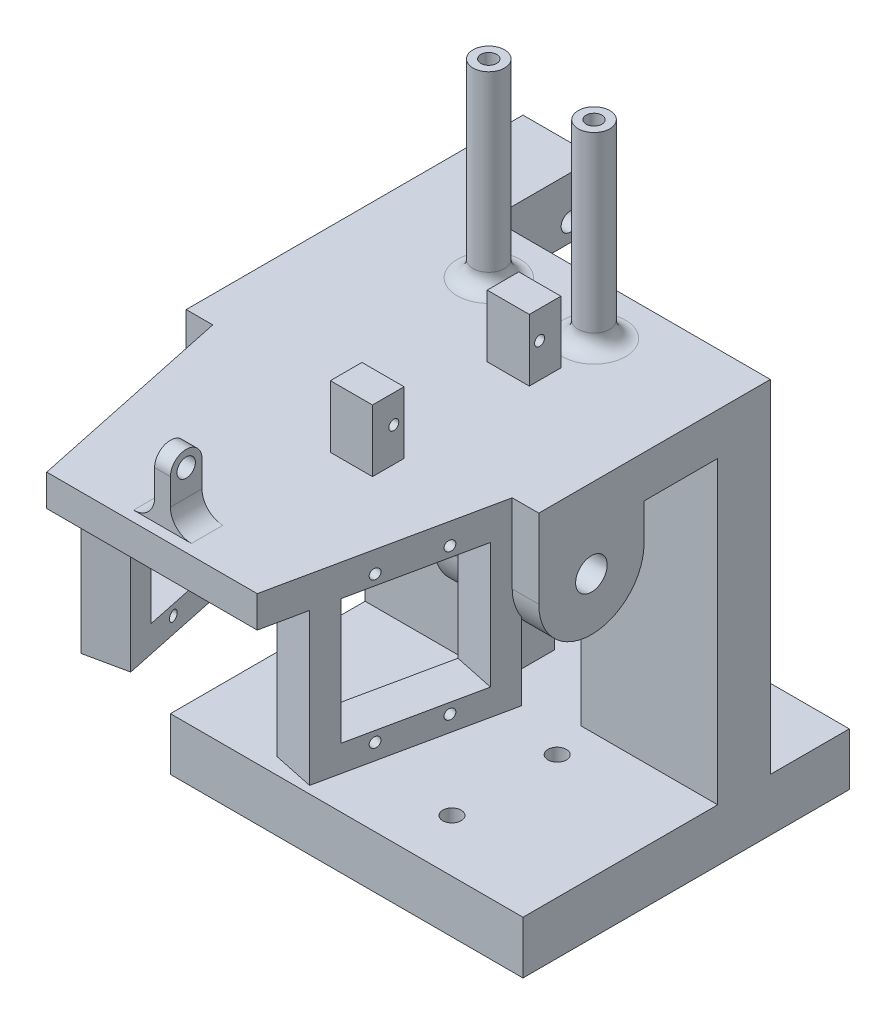
from build123d import *

# Parameters (mm, degrees)
SKETCH_1_W             = 67
SKETCH_1_H             = 62
EXTRUDE_1_DEPTH        = 10
SKETCH_3_W             = 14
SKETCH_3_H             = 20
EXTRUDE_2_DEPTH        = 12.5
SKETCH_4_W             = 10
SKETCH_4_H             = 65
EXTRUDE_3_DEPTH        = 67
SKETCH_5_W             = 67
SKETCH_5_H             = 44
EXTRUDE_4_DEPTH        = 8
EXTRUDE_5_DEPTH        = 20
CUT_EXTRUDE_START      = -6
CUT_EXTRUDE_1_DEPTH    = 8
EXTRUDE_6_DEPTH        = 6
SKETCH_9_R             = 3
CUT_EXTRUDE_2_DEPTH    = 23
SKETCH_10_W            = 24
SKETCH_10_H            = 23.8
EXTRUDE_7_DEPTH        = 8
SKETCH_12_W            = 14
SKETCH_12_H            = 20
EXTRUDE_8_DEPTH        = 11.5
SKETCH_13_R            = 0.95
CUT_EXTRUDE_4_DEPTH    = 8
SKETCH_14_W            = 8
SKETCH_14_H            = 6
EXTRUDE_9_DEPTH        = 11.8
SKETCH_15_R            = 0.95
CUT_EXTRUDE_5_DEPTH    = 11.8
SKETCH_16_W            = 3
SKETCH_16_H            = 6
EXTRUDE_10_DEPTH       = 12
FILLET_1_RADIUS        = 3
FILLET_1_LENGTH        = 3
SKETCH_17_R            = 1.75
CUT_EXTRUDE_6_DEPTH    = 7
SKETCH_18_R            = 3
EXTRUDE_11_DEPTH       = 36
FILLET_2_R             = 3
FILLET_2_OF_MIRROR_1_R = 3
SKETCH_20_R            = 1.75
CUT_EXTRUDE_7_DEPTH    = 35
SKETCH_21_W            = 15
SKETCH_21_H            = 55
CUT_EXTRUDE_8_DEPTH    = 35
SKETCH_24_R            = 1.75
CUT_EXTRUDE_11_DEPTH   = 18
SKETCH_25_R            = 1.5
CUT_EXTRUDE_12_DEPTH   = 10
FILLET_3_R             = 4
SKETCH_26_W            = 10
SKETCH_26_H            = 3.6
EXTRUDE_12_DEPTH       = 1
SKETCH_27_R            = 1.4
CUT_EXTRUDE_13_DEPTH   = 4


with BuildPart() as part:
    # 草图1 → 凸台-拉伸1 (new body)
    with BuildSketch(Plane(origin=(0, 0, 0), x_dir=(1, 0, 0), z_dir=(0, 1, 0))):
        Rectangle(SKETCH_1_W, SKETCH_1_H)
    extrude(amount=EXTRUDE_1_DEPTH)

    # 草图3 → 凸台-拉伸2 (add)
    with BuildSketch(Plane(origin=(0, 10, 0), x_dir=(1, 0, 0), z_dir=(0, 1, 0))):
        with Locations((-26.5, 26)):
            Rectangle(SKETCH_3_W, SKETCH_3_H)
    extrude(amount=EXTRUDE_2_DEPTH)

    # 草图4 → 凸台-拉伸3 (add)
    with BuildSketch(Plane.ZY.offset(33.5)):
        with Locations((-11, 42.5)):
            Rectangle(SKETCH_4_W, SKETCH_4_H)
    extrude(amount=-EXTRUDE_3_DEPTH)

    # 草图5 → 凸台-拉伸4 (add)
    with BuildSketch(Plane(origin=(0, 75, 0), x_dir=(1, 0, 0), z_dir=(0, 1, 0))):
        with Locations((0, -6)):
            Rectangle(SKETCH_5_W, SKETCH_5_H)
    extrude(amount=-EXTRUDE_4_DEPTH)

    # 草图6 → 凸台-拉伸5 (add)
    with BuildSketch(Plane(origin=(33.5, 0, 0), x_dir=(0, 0, -1), z_dir=(1, 0, 0))):
        with BuildLine():
            Line((-28, 60), (-28, 67))
            Line((-28, 67), (-8, 67))
            Line((-8, 67), (-8, 60))
            ThreePointArc((-8, 60), (-18, 50), (-28, 60))
        make_face()
    extrude_5 = extrude(amount=-EXTRUDE_5_DEPTH)

    # 草图7 → 切除-拉伸1 (cut)
    with BuildSketch(Plane(origin=(33.5, 0, 0), x_dir=(0, 0, -1), z_dir=(1, 0, 0)).offset(CUT_EXTRUDE_START)):
        with BuildLine():
            Line((-28, 60), (-28, 70.000230089))
            Line((-28, 70.000230089), (-8, 70.000230089))
            Line((-8, 70.000230089), (-8, 60))
            ThreePointArc((-8, 60), (-18, 50), (-28, 60))
        make_face()
    cut_extrude_1 = extrude(amount=-CUT_EXTRUDE_1_DEPTH, mode=Mode.SUBTRACT)

    # 草图8 → 凸台-拉伸6 (add)
    with BuildSketch(Plane(origin=(0, 75, 0), x_dir=(1, 0, 0), z_dir=(0, 1, 0))):
        Polygon((0, -68), (20, -68), (28.452456914, -28), (0, -28), align=None)
    extrude_6 = extrude(amount=-EXTRUDE_6_DEPTH)

    # 草图9 → 切除-拉伸2 (cut)
    with BuildSketch(Plane(origin=(33.5, 0, 0), x_dir=(0, 0, -1), z_dir=(1, 0, 0))):
        with Locations((-18, 60)):
            Circle(SKETCH_9_R)
    cut_extrude_2 = extrude(amount=-CUT_EXTRUDE_2_DEPTH, mode=Mode.SUBTRACT)

    # 草图10 → 凸台-拉伸7 (add)
    with BuildSketch(Plane(origin=(32.900104274, 0, 6.952167846), x_dir=(0.20674596709610937, 0, -0.9783946571243602), z_dir=(0.9783946571243602, 0, 0.20674596709610937))):
        Polygon((-49, 75), (-20, 75), (-20, 40.2), (-48, 40.2), (-54, 40.2), (-54, 75), align=None)
        with Locations((-37, 57.1)):
            Rectangle(SKETCH_10_W, SKETCH_10_H, mode=Mode.SUBTRACT)
    extrude_7 = extrude(amount=-EXTRUDE_7_DEPTH)

    # 草图12 → 凸台-拉伸8 (add)
    with BuildSketch(Plane(origin=(0, 75, 0), x_dir=(1, 0, 0), z_dir=(0, 1, 0))):
        with Locations((-26.5, 26)):
            Rectangle(SKETCH_12_W, SKETCH_12_H)
    extrude(amount=-EXTRUDE_8_DEPTH)

    # 草图13 → 切除-拉伸4 (cut)
    with BuildSketch(Plane(origin=(25.072947017, 0, 5.298200109), x_dir=(-0.20674596709610943, 0, 0.9783946571243602), z_dir=(-0.9783946571243602, 0, -0.20674596709610943))):
        with Locations((43.5, 70.95)):
            Circle(SKETCH_13_R)
        with Locations((31.5, 70.95)):
            Circle(SKETCH_13_R)
        with Locations((31.5, 43.25)):
            Circle(SKETCH_13_R)
        with Locations((43.5, 43.25)):
            Circle(SKETCH_13_R)
    cut_extrude_4 = extrude(amount=-CUT_EXTRUDE_4_DEPTH, mode=Mode.SUBTRACT)

    # 草图14 → 凸台-拉伸9 (add)
    with BuildSketch(Plane(origin=(0, 75, 0), x_dir=(1, 0, 0), z_dir=(0, 1, 0))):
        with Locations((7.7, -5)):
            Rectangle(SKETCH_14_W, SKETCH_14_H)
        with Locations((7.7, -34.8)):
            Rectangle(SKETCH_14_W, SKETCH_14_H)
    extrude(amount=EXTRUDE_9_DEPTH)

    # 草图15 → 切除-拉伸5 (cut)
    with BuildSketch(Plane.ZY.offset(-3.7)):
        with Locations((33.75, 81.5)):
            Circle(SKETCH_15_R)
        with Locations((6.05, 81.5)):
            Circle(SKETCH_15_R)
    extrude(amount=-CUT_EXTRUDE_5_DEPTH, mode=Mode.SUBTRACT)

    # 草图16 → 凸台-拉伸10 (add)
    with BuildSketch(Plane(origin=(0, 75, 0), x_dir=(1, 0, 0), z_dir=(0, 1, 0))):
        with Locations((0, -63)):
            Rectangle(SKETCH_16_W, SKETCH_16_H)
    extrude(amount=EXTRUDE_10_DEPTH)

    # 圆角1: full round fillet: the end face becomes a half cylinder, R = half its width
    fillet_1_face = Plane((0, 87, 63), x_dir=(1, 0, 0), z_dir=(0, 1, 0))  # on the end face: x along it, z out of the body
    fillet_1_slab = fillet_1_face.offset(-FILLET_1_RADIUS / 2) * Box(FILLET_1_LENGTH, 2 * FILLET_1_RADIUS, FILLET_1_RADIUS, mode=Mode.PRIVATE)  # the body's end, R deep
    fillet_1_round = Plane((0, 84, 63), x_dir=(0, 1, 0), z_dir=(1, 0, 0)) * Cylinder(FILLET_1_RADIUS, FILLET_1_LENGTH, mode=Mode.PRIVATE)  # its axis R under the face
    add(fillet_1_slab - fillet_1_round, mode=Mode.SUBTRACT)

    # 草图17 → 切除-拉伸6 (cut)
    with BuildSketch(Plane.ZY.offset(1.5)):
        with Locations((63, 84)):
            Circle(SKETCH_17_R)
    extrude(amount=-CUT_EXTRUDE_6_DEPTH, mode=Mode.SUBTRACT)

    # 草图18 → 凸台-拉伸11 (add)
    with BuildSketch(Plane(origin=(0, 75, 0), x_dir=(1, 0, 0), z_dir=(0, 1, 0))):
        with Locations(Location((10, 6, 0), (0, 0, 270))):
            Circle(SKETCH_18_R)
    extrude_11 = extrude(amount=EXTRUDE_11_DEPTH)

    # 圆角2
    fillet_2_edges = [part.edges().sort_by_distance(p)[0] for p in [
        (10, 75, -9),
    ]]
    fillet(fillet_2_edges, radius=FILLET_2_R)

    # 镜向1: 凸台-拉伸5, 切除-拉伸1, 凸台-拉伸6, 切除-拉伸2, 凸台-拉伸7, 切除-拉伸4, 凸台-拉伸11 across plane
    add(extrude_5.mirror(Plane(origin=(0, 0, 0), x_dir=(0, 0, 1), z_dir=(1, 0, 0))))
    add(cut_extrude_1.mirror(Plane(origin=(0, 0, 0), x_dir=(0, 0, 1), z_dir=(1, 0, 0))), mode=Mode.SUBTRACT)
    add(extrude_6.mirror(Plane(origin=(0, 0, 0), x_dir=(0, 0, 1), z_dir=(1, 0, 0))))
    add(cut_extrude_2.mirror(Plane(origin=(0, 0, 0), x_dir=(0, 0, 1), z_dir=(1, 0, 0))), mode=Mode.SUBTRACT)
    add(extrude_7.mirror(Plane(origin=(0, 0, 0), x_dir=(0, 0, 1), z_dir=(1, 0, 0))))
    add(cut_extrude_4.mirror(Plane(origin=(0, 0, 0), x_dir=(0, 0, 1), z_dir=(1, 0, 0))), mode=Mode.SUBTRACT)
    add(extrude_11.mirror(Plane(origin=(0, 0, 0), x_dir=(0, 0, 1), z_dir=(1, 0, 0))))

    # 圆角2 of 镜向1
    fillet_2_of_mirror_1_edges = [part.edges().sort_by_distance(p)[0] for p in [
        (-10, 75, -9),
    ]]
    fillet(fillet_2_of_mirror_1_edges, radius=FILLET_2_OF_MIRROR_1_R)

    # 草图20 → 切除-拉伸7 (cut)
    with BuildSketch(Plane.ZY.offset(33.5)):
        with Locations((-31, 67)):
            Circle(SKETCH_20_R)
        with Locations((-21, 67)):
            Circle(SKETCH_20_R)
        with Locations((-31, 19)):
            Circle(SKETCH_20_R)
        with Locations((-21, 19)):
            Circle(SKETCH_20_R)
    extrude(amount=-CUT_EXTRUDE_7_DEPTH, mode=Mode.SUBTRACT)

    # 草图21 → 切除-拉伸8 (cut)
    with BuildSketch(Plane(origin=(0, 0, -16), x_dir=(-1, 0, 0), z_dir=(0, 0, -1))):
        with Locations((0, 37.5)):
            Rectangle(SKETCH_21_W, SKETCH_21_H)
    extrude(amount=-CUT_EXTRUDE_8_DEPTH, mode=Mode.SUBTRACT)

    # 草图24 → 切除-拉伸11 (cut)
    with BuildSketch(Plane(origin=(0, 10, 0), x_dir=(1, 0, 0), z_dir=(0, 1, 0))):
        with Locations(Location((-10, -21, 0), (0, 0, 270))):
            Circle(SKETCH_24_R)
        with Locations(Location((10, -21, 0), (0, 0, 270))):
            Circle(SKETCH_24_R)
        with Locations(Location((-10, -1, 0), (0, 0, 270))):
            Circle(SKETCH_24_R)
        with Locations(Location((10, -1, 0), (0, 0, 270))):
            Circle(SKETCH_24_R)
    extrude(amount=-CUT_EXTRUDE_11_DEPTH, mode=Mode.SUBTRACT)

    # 草图25 → 切除-拉伸12 (cut)
    with BuildSketch(Plane(origin=(0, 111, 0), x_dir=(1, 0, 0), z_dir=(0, 1, 0))):
        with Locations(Location((10, 6, 0), (0, 0, 270))):
            Circle(SKETCH_25_R)
        with Locations(Location((-10, 6, 0), (0, 0, 270))):
            Circle(SKETCH_25_R)
    extrude(amount=-CUT_EXTRUDE_12_DEPTH, mode=Mode.SUBTRACT)

    # 圆角3
    fillet_3_edges = [part.edges().sort_by_distance(p)[0] for p in [
        (-1.5, 75, 63),
        (1.5, 75, 63),
    ]]
    fillet(fillet_3_edges, radius=FILLET_3_R)

    # 草图26 → 凸台-拉伸12 (add)
    with BuildSketch(Plane.XZ.offset(-69)):
        with Locations((0, 62.1)):
            Rectangle(SKETCH_26_W, SKETCH_26_H)
    extrude(amount=EXTRUDE_12_DEPTH)

    # 草图27 → 切除-拉伸13 (cut)
    with BuildSketch(Plane.XZ.offset(-68)):
        with Locations(Location((0, 62, 0), (0, 0, 270))):
            Circle(SKETCH_27_R)
    extrude(amount=-CUT_EXTRUDE_13_DEPTH, mode=Mode.SUBTRACT)


solid = part.part
